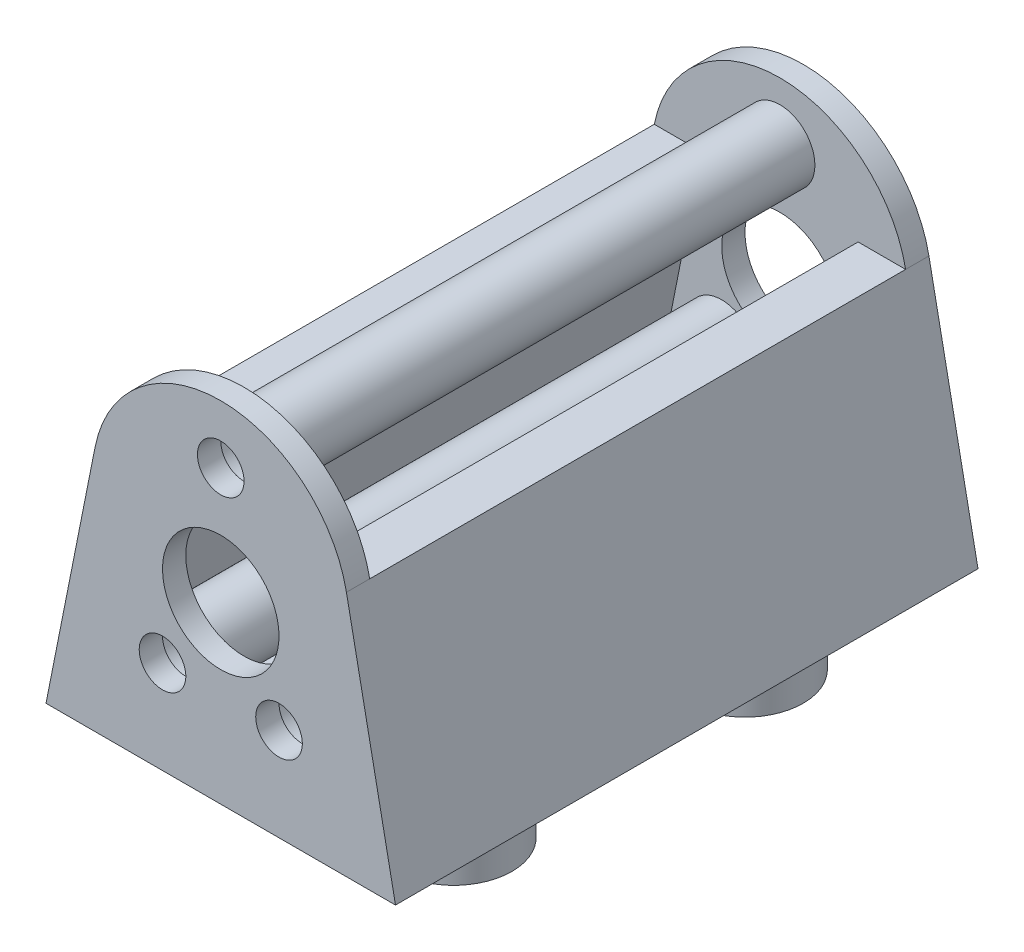
from build123d import *

# Parameters (mm, degrees)
SKETCH1_R           = 5
SKETCH1_R_2         = 2
BOSS_EXTRUDE1_DEPTH = 2
SKETCH2_R           = 2
SKETCH2_R_2         = 5
BOSS_EXTRUDE2_DEPTH = 2
SKETCH3_R           = 3
SKETCH3_R_2         = 2.5
BOSS_EXTRUDE3_DEPTH = 46
BOSS_EXTRUDE5_DEPTH = 46
SKETCH7_R           = 5
SKETCH7_R_2         = 2.5
BOSS_EXTRUDE6_DEPTH = 5


with BuildPart() as part:
    # Sketch1 → Boss-Extrude1 (new body)
    with BuildSketch(Plane.XY):
        with BuildLine():
            Line((-15, 0), (15, 0))
            Line((15, 0), (10.788133888, 21.148526754))
            ThreePointArc((10.788133888, 21.148526754), (0, 30), (-10.788133888, 21.148526754))
            Line((-10.788133888, 21.148526754), (-15, 0))
        make_face()
        with Locations((0, 15)):
            Circle(SKETCH1_R, mode=Mode.SUBTRACT)
        with Locations((5, 8)):
            Circle(SKETCH1_R_2, mode=Mode.SUBTRACT)
        with Locations((-5, 8)):
            Circle(SKETCH1_R_2, mode=Mode.SUBTRACT)
        with Locations((0, 25)):
            Circle(SKETCH1_R_2, mode=Mode.SUBTRACT)
    extrude(amount=BOSS_EXTRUDE1_DEPTH)



with BuildPart() as body_2:
    # Sketch2 → Boss-Extrude2 (new body)
    with BuildSketch(Plane(origin=(0, 0, 50), x_dir=(-1, 0, 0), z_dir=(0, 0, -1))):
        with BuildLine():
            Line((-10.788133888, 21.148526754), (-15, 0))
            Line((-15, 0), (15, 0))
            Line((15, 0), (10.788133888, 21.148526754))
            ThreePointArc((10.788133888, 21.148526754), (0, 30), (-10.788133888, 21.148526754))
        make_face()
        with Locations(Location((-5, 8, 0), (0, 0, 180))):
            Circle(SKETCH2_R, mode=Mode.SUBTRACT)
        with Locations(Location((5, 8, 0), (0, 0, 180))):
            Circle(SKETCH2_R, mode=Mode.SUBTRACT)
        with Locations(Location((0, 25, 0), (0, 0, 180))):
            Circle(SKETCH2_R, mode=Mode.SUBTRACT)
        with Locations(Location((0, 15, 0), (0, 0, 180))):
            Circle(SKETCH2_R_2, mode=Mode.SUBTRACT)
    extrude(amount=BOSS_EXTRUDE2_DEPTH)


with BuildPart() as part_1:
    add(part.part)

    add(body_2.part)  # Boss-Extrude3 merges body 2
    # Sketch3 → Boss-Extrude3 (add)
    # profile 1 of 3: a face of its own
    with BuildSketch(Plane.XY.offset(2)):
        with Locations(Location((5, 8, 0), (0, 0, 180))):
            Circle(SKETCH3_R)
        with Locations(Location((5, 8, 0), (0, 0, 180))):
            Circle(SKETCH3_R_2, mode=Mode.SUBTRACT)
    # profile 2 of 3: a face of its own
    with BuildSketch(Plane.XY.offset(2)):
        with Locations(Location((0, 25, 0), (0, 0, 180))):
            Circle(SKETCH3_R)
        with Locations(Location((0, 25, 0), (0, 0, 180))):
            Circle(SKETCH3_R_2, mode=Mode.SUBTRACT)
    # profile 3 of 3: a face of its own
    with BuildSketch(Plane.XY.offset(2)):
        with Locations(Location((-5, 8, 0), (0, 0, 180))):
            Circle(SKETCH3_R)
        with Locations(Location((-5, 8, 0), (0, 0, 180))):
            Circle(SKETCH3_R_2, mode=Mode.SUBTRACT)
    extrude(amount=BOSS_EXTRUDE3_DEPTH)

    # Sketch4 → Boss-Extrude5 (add)
    with BuildSketch(Plane.XY.offset(2)):
        Polygon((-10.788133888, 21.148526754), (-14.203374086, 4), (-10.124818846, 4), (-6.709578648, 21.148526754), align=None)
        Polygon((10.124818846, 4), (14.203374086, 4), (10.788133888, 21.148526754), (6.709578648, 21.148526754), align=None)
        Polygon((-14.203374086, 4), (-15, 0), (15, 0), (14.203374086, 4), (10.124818846, 4), (-10.124818846, 4), align=None)
    extrude(amount=BOSS_EXTRUDE5_DEPTH)

    # Sketch7 → Boss-Extrude6 (add)
    # profile 1 of 4: a face of its own
    with BuildSketch(Plane.XZ):
        with Locations(Location((7.5, 37.5, 0), (0, 0, 90))):
            Circle(SKETCH7_R)
        with Locations(Location((7.5, 37.5, 0), (0, 0, 270))):
            Circle(SKETCH7_R_2, mode=Mode.SUBTRACT)
    # profile 2 of 4: a face of its own
    with BuildSketch(Plane.XZ):
        with Locations(Location((7.5, 12.5, 0), (0, 0, 90))):
            Circle(SKETCH7_R)
        with Locations(Location((7.5, 12.5, 0), (0, 0, 90))):
            Circle(SKETCH7_R_2, mode=Mode.SUBTRACT)
    # profile 3 of 4: a face of its own
    with BuildSketch(Plane.XZ):
        with Locations(Location((-7.5, 12.5, 0), (0, 0, 90))):
            Circle(SKETCH7_R)
        with Locations(Location((-7.5, 12.5, 0), (0, 0, 270))):
            Circle(SKETCH7_R_2, mode=Mode.SUBTRACT)
    # profile 4 of 4: a face of its own
    with BuildSketch(Plane.XZ):
        with Locations(Location((-7.5, 37.5, 0), (0, 0, 90))):
            Circle(SKETCH7_R)
        with Locations(Location((-7.5, 37.5, 0), (0, 0, 90))):
            Circle(SKETCH7_R_2, mode=Mode.SUBTRACT)
    extrude(amount=BOSS_EXTRUDE6_DEPTH)


solid = part_1.part
